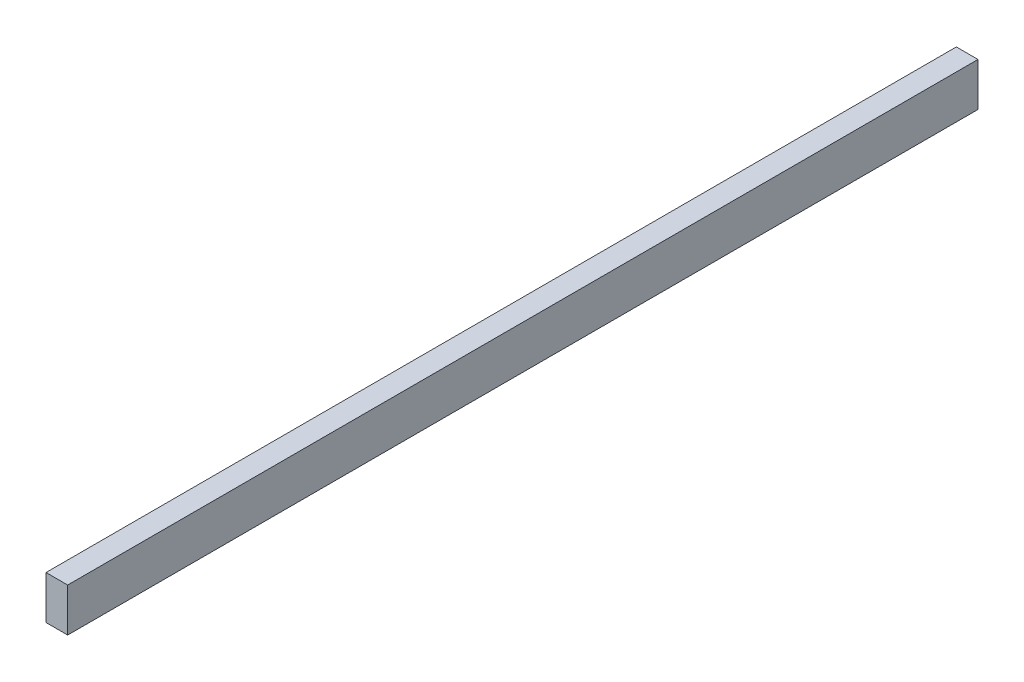
from build123d import *

# Parameters (mm, degrees)
SKETCH1_W           = 25.4
SKETCH1_H           = 50.8
BOSS_EXTRUDE1_DEPTH = 1066.8


with BuildPart() as part:
    # Sketch1 → Boss-Extrude1 (new body)
    with BuildSketch(Plane.XY):
        Rectangle(SKETCH1_W, SKETCH1_H)
    extrude(amount=BOSS_EXTRUDE1_DEPTH)


solid = part.part
